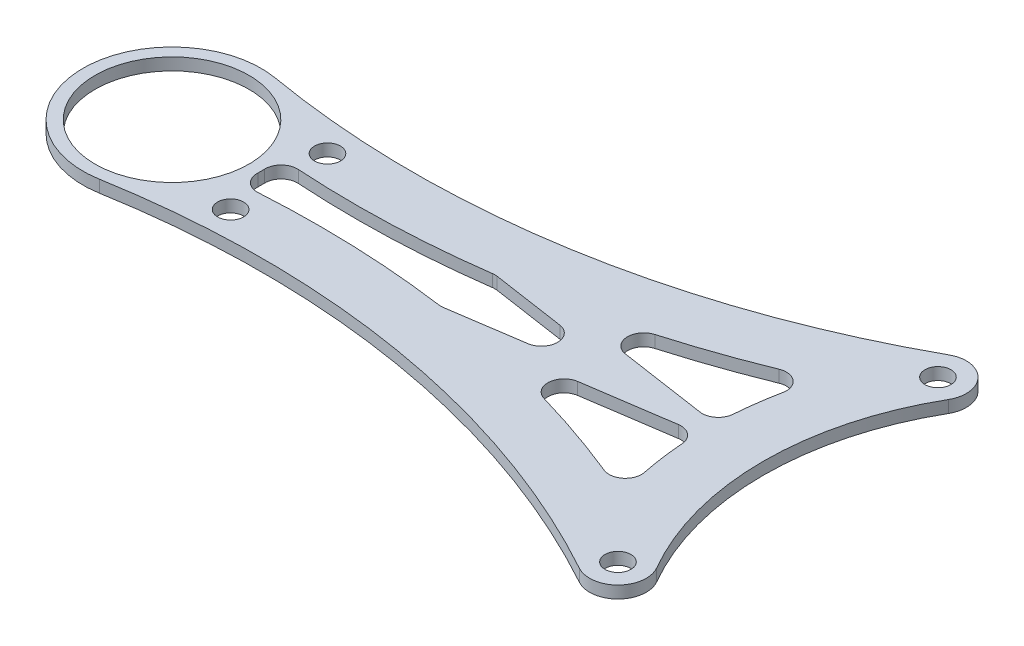
from build123d import *

# Parameters (mm, degrees)
SKETCH1_R                      = 3.5
BOSS_EXTRUDE1_DEPTH            = 0.75
F_3_2_3_2_DIAMETER_HOLE1_D     = 3.2
F_3_2_3_2_DIAMETER_HOLE1_DEPTH = 10
F_3_2_3_2_DIAMETER_HOLE1_TIP   = 0.96137699
CUT_EXTRUDE1_DEPTH             = 123.2407972
FILLET1_R                      = 2
SKETCH7_R                      = 9.5
CUT_EXTRUDE2_DEPTH             = 123.240797318


with BuildPart() as part:
    # Sketch1 → Boss-Extrude1 (new, symmetric)
    with BuildSketch(Plane(origin=(0, 0, 0), x_dir=(1, 0, 0), z_dir=(0, 1, 0))):
        with BuildLine():
            ThreePointArc((-37.239092363, -21.5), (-43, 0), (-37.239092363, 21.5))
            ThreePointArc((-37.239092363, 21.5), (-36.658838331, 22.248681329), (-35.899079455, 22.81435343))
            ThreePointArc((-35.899079455, 22.81435343), (-70.492179883, 10.7556392), (-107.126701642, 10.839315166))
            ThreePointArc((-107.126701642, 10.839315166), (-120, 0), (-107.126701642, -10.839315166))
            ThreePointArc((-107.126701642, -10.839315166), (-70.492179883, -10.7556392), (-35.899079455, -22.81435343))
            ThreePointArc((-35.899079455, -22.81435343), (-36.658838331, -22.248681329), (-37.239092363, -21.5))
        make_face()
        with BuildLine():
            ThreePointArc((-31.176914536, 18), (-35.958003449, 16.718911087), (-37.239092363, 21.5))
            ThreePointArc((-37.239092363, 21.5), (-43, 0), (-37.239092363, -21.5))
            ThreePointArc((-37.239092363, -21.5), (-35.958003449, -16.718911087), (-31.176914536, -18))
            ThreePointArc((-31.176914536, -18), (-36, 0), (-31.176914536, 18))
        make_face()
        with Locations((-34.208003449, -19.75)):
            Circle(SKETCH1_R)
        with Locations((-34.208003449, 19.75)):
            Circle(SKETCH1_R)
    extrude(amount=BOSS_EXTRUDE1_DEPTH, both=True)

    # Ø3.2 (3.2) Diameter Hole1
    with Locations(Plane(origin=(0, 0.75, 0), x_dir=(1, 0, 0), z_dir=(0, 1, 0))):
        with Locations((-34.208003449, 19.75), (-34.208003449, -19.75), (-95.790276336, 5.979398024), (-95.790276336, -5.979398024)):
            Hole(F_3_2_3_2_DIAMETER_HOLE1_D / 2, depth=F_3_2_3_2_DIAMETER_HOLE1_DEPTH)
            with Locations((0, 0, -(F_3_2_3_2_DIAMETER_HOLE1_DEPTH + F_3_2_3_2_DIAMETER_HOLE1_TIP / 2))):  # 118° drill point
                Cone(0, F_3_2_3_2_DIAMETER_HOLE1_D / 2, F_3_2_3_2_DIAMETER_HOLE1_TIP, mode=Mode.SUBTRACT)

    # Sketch6 → Cut-Extrude1 (cut, through all)
    with BuildSketch(Plane(origin=(0, 0.75, 0), x_dir=(1, 0, 0), z_dir=(0, 1, 0))):
        with BuildLine():
            Line((-72.469338063, -3.369046694), (-49.802019621, 0))
            Line((-49.802019621, 0), (-72.469338063, 3.369046694))
            ThreePointArc((-72.469338063, 3.369046694), (-85.377857375, 2.290839769), (-98.326107181, 2.65857332))
            ThreePointArc((-98.326107181, 2.65857332), (-98, 0), (-98.326107181, -2.65857332))
            ThreePointArc((-98.326107181, -2.65857332), (-85.377857375, -2.290839769), (-72.469338063, -3.369046694))
        make_face()
        with BuildLine():
            Line((-66.096117167, 4.443764231), (-42.988154947, 1.009224591))
            ThreePointArc((-42.988154947, 1.009224591), (-42.467311238, 6.747405149), (-41.183985346, 12.36443897))
            ThreePointArc((-41.183985346, 12.36443897), (-53.416219701, 7.70010587), (-66.096117167, 4.443764231))
        make_face()
        with BuildLine():
            ThreePointArc((-41.183985346, -12.36443897), (-42.467311238, -6.747405149), (-42.988154947, -1.009224591))
            Line((-42.988154947, -1.009224591), (-66.096117167, -4.443764231))
            ThreePointArc((-66.096117167, -4.443764231), (-53.416219701, -7.70010587), (-41.183985346, -12.36443897))
        make_face()
    extrude(amount=-CUT_EXTRUDE1_DEPTH, mode=Mode.SUBTRACT)

    # Fillet1
    fillet1_edges = [part.edges().sort_by_distance(p)[0] for p in [
        (-98.326107181, 0, 2.65857332),
        (-98.326107181, 0, -2.65857332),
        (-72.469338063, 0, -3.369046694),
        (-49.802019621, 0, 0),
        (-72.469338063, 0, 3.369046694),
        (-41.183985346, 0, -12.36443897),
        (-42.988154947, 0, -1.009224591),
        (-66.096117167, 0, -4.443764231),
        (-42.988154947, 0, 1.009224591),
        (-41.183985346, 0, 12.36443897),
        (-66.096117167, 0, 4.443764231),
    ]]
    fillet(fillet1_edges, radius=FILLET1_R)

    # Sketch7 → Cut-Extrude2 (cut, through all)
    with BuildSketch(Plane(origin=(0, 0.75, 0), x_dir=(1, 0, 0), z_dir=(0, 1, 0))):
        with Locations(Location((-109, 0, 0), (0, 0, 270))):
            Circle(SKETCH7_R)
    extrude(amount=-CUT_EXTRUDE2_DEPTH, mode=Mode.SUBTRACT)


solid = part.part
